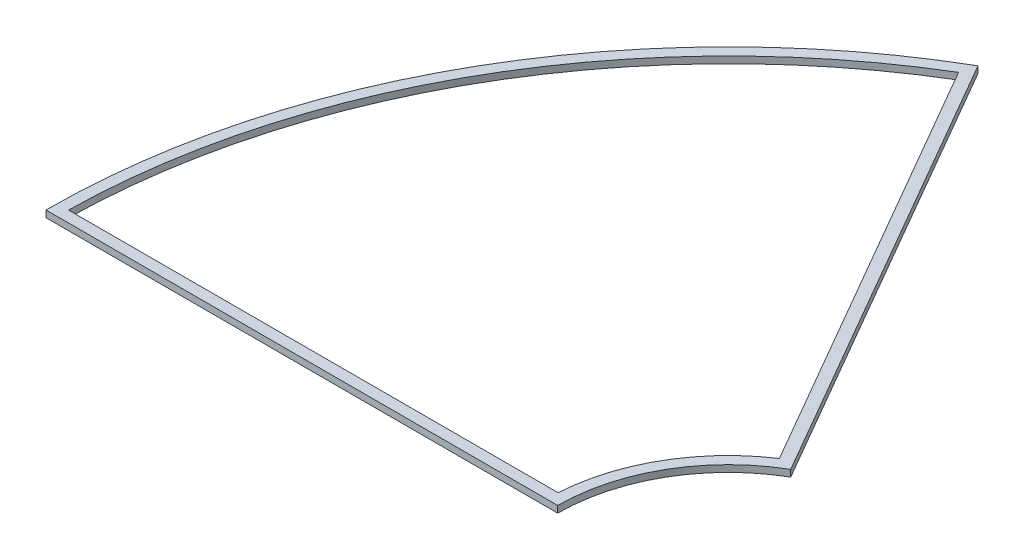
from build123d import *

# Parameters (mm, degrees)
BOSS_EXTRUDE1_DEPTH = 6


with BuildPart() as part:
    # Sketch1 → Boss-Extrude1 (new body)
    with BuildSketch(Plane(origin=(0, 0, 0), x_dir=(1, 0, 0), z_dir=(0, 1, 0))):
        with BuildLine():
            ThreePointArc((-76.2, 131.982271537), (-131.982271537, 76.2), (-152.4, 0))
            Line((-152.4, 0), (-609.6, 0))
            ThreePointArc((-609.6, 0), (-527.929086147, 304.8), (-304.8, 527.929086147))
            Line((-304.8, 527.929086147), (-76.2, 131.982271537))
        make_face()
        with BuildLine():
            ThreePointArc((-599.516605275, 10), (-578.516992176, 157.601553812), (-521.750777563, 295.459449184))
            ThreePointArc((-521.750777563, 295.459449184), (-519.268832109, 299.8), (-516.750777563, 304.119703222))
            ThreePointArc((-516.750777563, 304.119703222), (-425.745445365, 422.209634839), (-308.418556675, 514.196610158))
            Line((-308.418556675, 514.196610158), (-176.260254038, 285.291715349))
            Line((-176.260254038, 285.291715349), (-171.260254038, 276.631461311))
            Line((-171.260254038, 276.631461311), (-89.706166951, 135.375638912))
            ThreePointArc((-89.706166951, 135.375638912), (-140.642525575, 81.2), (-162.091825827, 10))
            Line((-162.091825827, 10), (-325.2, 10))
            Line((-325.2, 10), (-335.2, 10))
            Line((-335.2, 10), (-599.516605275, 10))
        make_face(mode=Mode.SUBTRACT)
    extrude(amount=BOSS_EXTRUDE1_DEPTH)


solid = part.part
